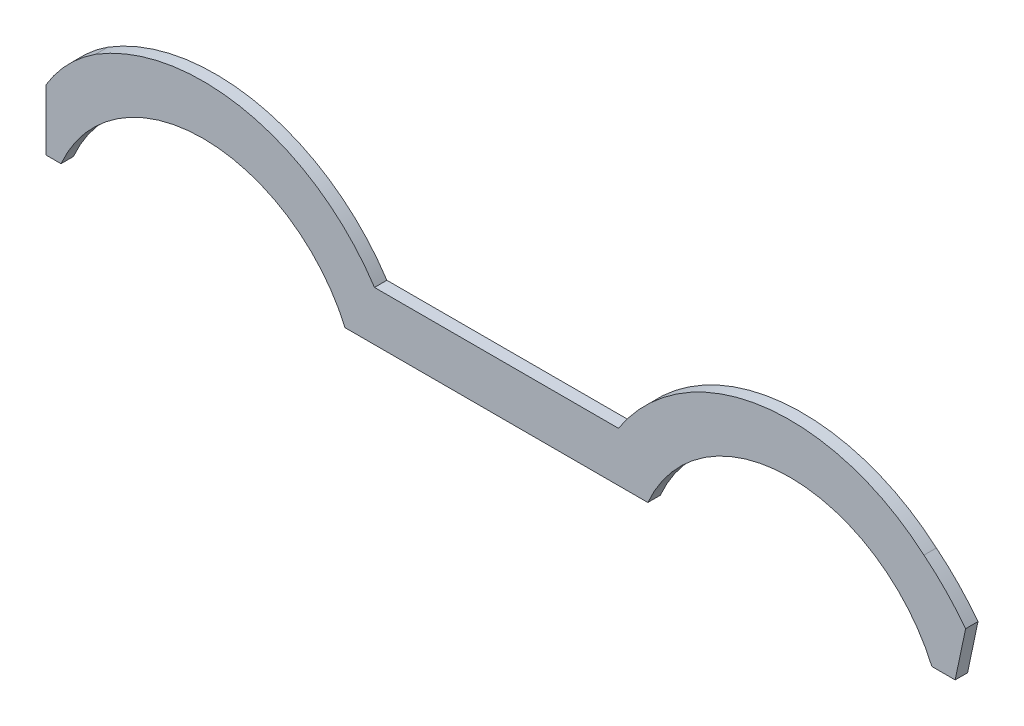
from build123d import *

# Parameters (mm, degrees)
BOSS_EXTRUDE1_DEPTH = 3


with BuildPart() as part:
    # Sketch1 → Boss-Extrude1 (new body)
    with BuildSketch(Plane.XY):
        with BuildLine():
            Line((-5.630682288, 0), (0, 0))
            Line((0, 0), (2.527819158, 12))
            ThreePointArc((2.527819158, 12), (-2.1947123, 17.496295373), (-7.549171204, 22.379054435))
            ThreePointArc((-7.549171204, 22.379054435), (-46.881030658, 34.019398375), (-81.487950058, 12))
            Line((-81.487950058, 12), (-140.512049942, 12))
            ThreePointArc((-140.512049942, 12), (-171.177028416, 33.302311395), (-208, 27.121847063))
            ThreePointArc((-208, 27.121847063), (-214.715828047, 21.616866872), (-220, 14.725954012))
            Line((-220, 14.725954012), (-220, 0))
            Line((-220, 0), (-216.369317712, 0))
            ThreePointArc((-216.369317712, 0), (-182, 22.5), (-147.630682288, 0))
            Line((-147.630682288, 0), (-74.369317712, 0))
            ThreePointArc((-74.369317712, 0), (-40, 22.5), (-5.630682288, 0))
        make_face()
    extrude(amount=BOSS_EXTRUDE1_DEPTH)


solid = part.part
